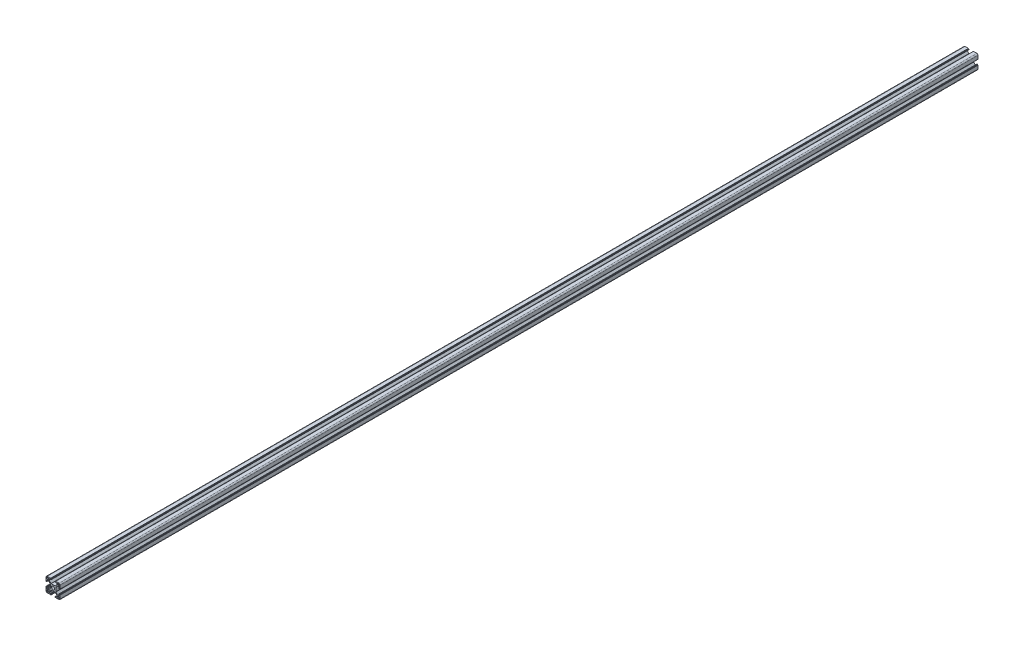
from build123d import *

# Parameters (mm, degrees)
SKETCH1_R           = 3.4
BOSS_EXTRUDE1_DEPTH = 1940


with BuildPart() as part:
    # Sketch1 → Boss-Extrude1 (new body)
    with BuildSketch(Plane.XY):
        with BuildLine():
            Line((0, 2.5), (0, 10.6))
            ThreePointArc((0, 10.6), (0.058578644, 10.741421356), (0.2, 10.8))
            Line((0.2, 10.8), (1, 10.8))
            ThreePointArc((1, 10.8), (1.141421356, 10.741421356), (1.2, 10.6))
            Line((1.2, 10.6), (1.2, 9.9))
            ThreePointArc((1.2, 9.9), (1.258578644, 9.758578644), (1.4, 9.7))
            Line((1.4, 9.7), (2, 9.7))
            ThreePointArc((2, 9.7), (2.141421356, 9.641421356), (2.2, 9.5))
            Line((2.2, 9.5), (2.2, 7.4))
            ThreePointArc((2.2, 7.4), (2.419669914, 6.869669914), (2.95, 6.65))
            Line((2.95, 6.65), (4.78370491, 6.65))
            ThreePointArc((4.78370491, 6.65), (5.070717484, 6.707090351), (5.314034995, 6.869669914))
            Line((5.314034995, 6.869669914), (8.980330086, 10.535965005))
            ThreePointArc((8.980330086, 10.535965005), (9.142909649, 10.779282516), (9.2, 11.06629509))
            Line((9.2, 11.06629509), (9.2, 18.93370491))
            ThreePointArc((9.2, 18.93370491), (9.142909649, 19.220717484), (8.980330086, 19.464034995))
            Line((8.980330086, 19.464034995), (5.314034995, 23.130330086))
            ThreePointArc((5.314034995, 23.130330086), (5.070717484, 23.292909649), (4.78370491, 23.35))
            Line((4.78370491, 23.35), (2.95, 23.35))
            ThreePointArc((2.95, 23.35), (2.419669914, 23.130330086), (2.2, 22.6))
            Line((2.2, 22.6), (2.2, 20.5))
            ThreePointArc((2.2, 20.5), (2.141421356, 20.358578644), (2, 20.3))
            Line((2, 20.3), (1.4, 20.3))
            ThreePointArc((1.4, 20.3), (1.258578644, 20.241421356), (1.2, 20.1))
            Line((1.2, 20.1), (1.2, 19.4))
            ThreePointArc((1.2, 19.4), (1.141421356, 19.258578644), (1, 19.2))
            Line((1, 19.2), (0.2, 19.2))
            ThreePointArc((0.2, 19.2), (0.058578644, 19.258578644), (0, 19.4))
            Line((0, 19.4), (0, 27.5))
            ThreePointArc((0, 27.5), (0.732233047, 29.267766953), (2.5, 30))
            Line((2.5, 30), (9.5, 30))
            ThreePointArc((9.5, 30), (9.641421356, 29.941421356), (9.7, 29.8))
            Line((9.7, 29.8), (9.7, 29.2))
            ThreePointArc((9.7, 29.2), (9.758578644, 29.058578644), (9.9, 29))
            Line((9.9, 29), (10.6, 29))
            ThreePointArc((10.6, 29), (10.741421356, 28.941421356), (10.8, 28.8))
            Line((10.8, 28.8), (10.8, 28))
            ThreePointArc((10.8, 28), (10.741421356, 27.858578644), (10.6, 27.8))
            Line((10.6, 27.8), (7.4, 27.8))
            ThreePointArc((7.4, 27.8), (6.869669914, 27.580330086), (6.65, 27.05))
            Line((6.65, 27.05), (6.65, 25.21629509))
            ThreePointArc((6.65, 25.21629509), (6.707090351, 24.929282516), (6.869669914, 24.685965005))
            Line((6.869669914, 24.685965005), (10.535965005, 21.019669914))
            ThreePointArc((10.535965005, 21.019669914), (10.779282516, 20.857090351), (11.06629509, 20.8))
            Line((11.06629509, 20.8), (18.93370491, 20.8))
            ThreePointArc((18.93370491, 20.8), (19.220717484, 20.857090351), (19.464034995, 21.019669914))
            Line((19.464034995, 21.019669914), (23.130330086, 24.685965005))
            ThreePointArc((23.130330086, 24.685965005), (23.292909649, 24.929282516), (23.35, 25.21629509))
            Line((23.35, 25.21629509), (23.35, 27.05))
            ThreePointArc((23.35, 27.05), (23.130330086, 27.580330086), (22.6, 27.8))
            Line((22.6, 27.8), (19.4, 27.8))
            ThreePointArc((19.4, 27.8), (19.258578644, 27.858578644), (19.2, 28))
            Line((19.2, 28), (19.2, 28.8))
            ThreePointArc((19.2, 28.8), (19.258578644, 28.941421356), (19.4, 29))
            Line((19.4, 29), (20.1, 29))
            ThreePointArc((20.1, 29), (20.241421356, 29.058578644), (20.3, 29.2))
            Line((20.3, 29.2), (20.3, 29.8))
            ThreePointArc((20.3, 29.8), (20.358578644, 29.941421356), (20.5, 30))
            Line((20.5, 30), (27.5, 30))
            ThreePointArc((27.5, 30), (29.267766953, 29.267766953), (30, 27.5))
            Line((30, 27.5), (30, 20.5))
            ThreePointArc((30, 20.5), (29.941421356, 20.358578644), (29.8, 20.3))
            Line((29.8, 20.3), (29.2, 20.3))
            ThreePointArc((29.2, 20.3), (29.058578644, 20.241421356), (29, 20.1))
            Line((29, 20.1), (29, 19.4))
            ThreePointArc((29, 19.4), (28.941421356, 19.258578644), (28.8, 19.2))
            Line((28.8, 19.2), (28, 19.2))
            ThreePointArc((28, 19.2), (27.858578644, 19.258578644), (27.8, 19.4))
            Line((27.8, 19.4), (27.8, 22.6))
            ThreePointArc((27.8, 22.6), (27.580330086, 23.130330086), (27.05, 23.35))
            Line((27.05, 23.35), (25.21629509, 23.35))
            ThreePointArc((25.21629509, 23.35), (24.929282516, 23.292909649), (24.685965005, 23.130330086))
            Line((24.685965005, 23.130330086), (21.019669914, 19.464034995))
            ThreePointArc((21.019669914, 19.464034995), (20.857090351, 19.220717484), (20.8, 18.93370491))
            Line((20.8, 18.93370491), (20.8, 11.06629509))
            ThreePointArc((20.8, 11.06629509), (20.857090351, 10.779282516), (21.019669914, 10.535965005))
            Line((21.019669914, 10.535965005), (24.685965005, 6.869669914))
            ThreePointArc((24.685965005, 6.869669914), (24.929282516, 6.707090351), (25.21629509, 6.65))
            Line((25.21629509, 6.65), (27.05, 6.65))
            ThreePointArc((27.05, 6.65), (27.580330086, 6.869669914), (27.8, 7.4))
            Line((27.8, 7.4), (27.8, 10.6))
            ThreePointArc((27.8, 10.6), (27.858578644, 10.741421356), (28, 10.8))
            Line((28, 10.8), (28.8, 10.8))
            ThreePointArc((28.8, 10.8), (28.941421356, 10.741421356), (29, 10.6))
            Line((29, 10.6), (29, 9.9))
            ThreePointArc((29, 9.9), (29.058578644, 9.758578644), (29.2, 9.7))
            Line((29.2, 9.7), (29.8, 9.7))
            ThreePointArc((29.8, 9.7), (29.941421356, 9.641421356), (30, 9.5))
            Line((30, 9.5), (30, 2.5))
            ThreePointArc((30, 2.5), (29.267766953, 0.732233047), (27.5, 0))
            Line((27.5, 0), (19.4, 0))
            ThreePointArc((19.4, 0), (19.258578644, 0.058578644), (19.2, 0.2))
            Line((19.2, 0.2), (19.2, 1.132430858))
            ThreePointArc((19.2, 1.132430858), (19.258578644, 1.273852214), (19.4, 1.332430858))
            Line((19.4, 1.332430858), (20.1, 1.332430858))
            ThreePointArc((20.1, 1.332430858), (20.241421356, 1.391009502), (20.3, 1.532430858))
            Line((20.3, 1.532430858), (20.3, 2))
            ThreePointArc((20.3, 2), (20.358578644, 2.141421356), (20.5, 2.2))
            Line((20.5, 2.2), (22.6, 2.2))
            ThreePointArc((22.6, 2.2), (23.130330086, 2.419669914), (23.35, 2.95))
            Line((23.35, 2.95), (23.35, 4.916135768))
            ThreePointArc((23.35, 4.916135768), (23.292909649, 5.203148342), (23.130330086, 5.446465854))
            Line((23.130330086, 5.446465854), (19.464034995, 9.112760944))
            ThreePointArc((19.464034995, 9.112760944), (19.220717484, 9.275340508), (18.93370491, 9.332430858))
            Line((18.93370491, 9.332430858), (11.06629509, 9.332430858))
            ThreePointArc((11.06629509, 9.332430858), (10.779282516, 9.275340508), (10.535965005, 9.112760944))
            Line((10.535965005, 9.112760944), (6.869669914, 5.446465854))
            ThreePointArc((6.869669914, 5.446465854), (6.707090351, 5.203148342), (6.65, 4.916135768))
            Line((6.65, 4.916135768), (6.65, 3.082430858))
            ThreePointArc((6.65, 3.082430858), (6.869669914, 2.552100772), (7.4, 2.332430858))
            Line((7.4, 2.332430858), (9.5, 2.332430858))
            ThreePointArc((9.5, 2.332430858), (9.641421356, 2.273852214), (9.7, 2.132430858))
            Line((9.7, 2.132430858), (9.7, 1.532430858))
            ThreePointArc((9.7, 1.532430858), (9.758578644, 1.391009502), (9.9, 1.332430858))
            Line((9.9, 1.332430858), (10.6, 1.332430858))
            ThreePointArc((10.6, 1.332430858), (10.741421356, 1.273852214), (10.8, 1.132430858))
            Line((10.8, 1.132430858), (10.8, 0.2))
            ThreePointArc((10.8, 0.2), (10.741421356, 0.058578644), (10.6, 0))
            Line((10.6, 0), (2.5, 0))
            ThreePointArc((2.5, 0), (0.732233047, 0.732233047), (0, 2.5))
        make_face()
        with Locations((15, 15)):
            Circle(SKETCH1_R, mode=Mode.SUBTRACT)
        with BuildLine():
            Line((27.55, 1.45), (25.8, 1.45))
            ThreePointArc((25.8, 1.45), (25.092893219, 1.742893219), (24.8, 2.45))
            Line((24.8, 2.45), (24.8, 4.2))
            ThreePointArc((24.8, 4.2), (25.092893219, 4.907106781), (25.8, 5.2))
            Line((25.8, 5.2), (27.55, 5.2))
            ThreePointArc((27.55, 5.2), (28.257106781, 4.907106781), (28.55, 4.2))
            Line((28.55, 4.2), (28.55, 2.45))
            ThreePointArc((28.55, 2.45), (28.257106781, 1.742893219), (27.55, 1.45))
        make_face(mode=Mode.SUBTRACT)
        with BuildLine():
            Line((24.8, 25.8), (24.8, 27.55))
            ThreePointArc((24.8, 27.55), (25.092893219, 28.257106781), (25.8, 28.55))
            Line((25.8, 28.55), (27.55, 28.55))
            ThreePointArc((27.55, 28.55), (28.257106781, 28.257106781), (28.55, 27.55))
            Line((28.55, 27.55), (28.55, 25.8))
            ThreePointArc((28.55, 25.8), (28.257106781, 25.092893219), (27.55, 24.8))
            Line((27.55, 24.8), (25.8, 24.8))
            ThreePointArc((25.8, 24.8), (25.092893219, 25.092893219), (24.8, 25.8))
        make_face(mode=Mode.SUBTRACT)
        with BuildLine():
            Line((2.45, 28.55), (4.2, 28.55))
            ThreePointArc((4.2, 28.55), (4.907106781, 28.257106781), (5.2, 27.55))
            Line((5.2, 27.55), (5.2, 25.8))
            ThreePointArc((5.2, 25.8), (4.907106781, 25.092893219), (4.2, 24.8))
            Line((4.2, 24.8), (2.45, 24.8))
            ThreePointArc((2.45, 24.8), (1.742893219, 25.092893219), (1.45, 25.8))
            Line((1.45, 25.8), (1.45, 27.55))
            ThreePointArc((1.45, 27.55), (1.742893219, 28.257106781), (2.45, 28.55))
        make_face(mode=Mode.SUBTRACT)
        with BuildLine():
            Line((1.45, 2.45), (1.45, 4.2))
            ThreePointArc((1.45, 4.2), (1.742893219, 4.907106781), (2.45, 5.2))
            Line((2.45, 5.2), (4.2, 5.2))
            ThreePointArc((4.2, 5.2), (4.907106781, 4.907106781), (5.2, 4.2))
            Line((5.2, 4.2), (5.2, 2.45))
            ThreePointArc((5.2, 2.45), (4.907106781, 1.742893219), (4.2, 1.45))
            Line((4.2, 1.45), (2.45, 1.45))
            ThreePointArc((2.45, 1.45), (1.742893219, 1.742893219), (1.45, 2.45))
        make_face(mode=Mode.SUBTRACT)
    extrude(amount=BOSS_EXTRUDE1_DEPTH)


solid = part.part
